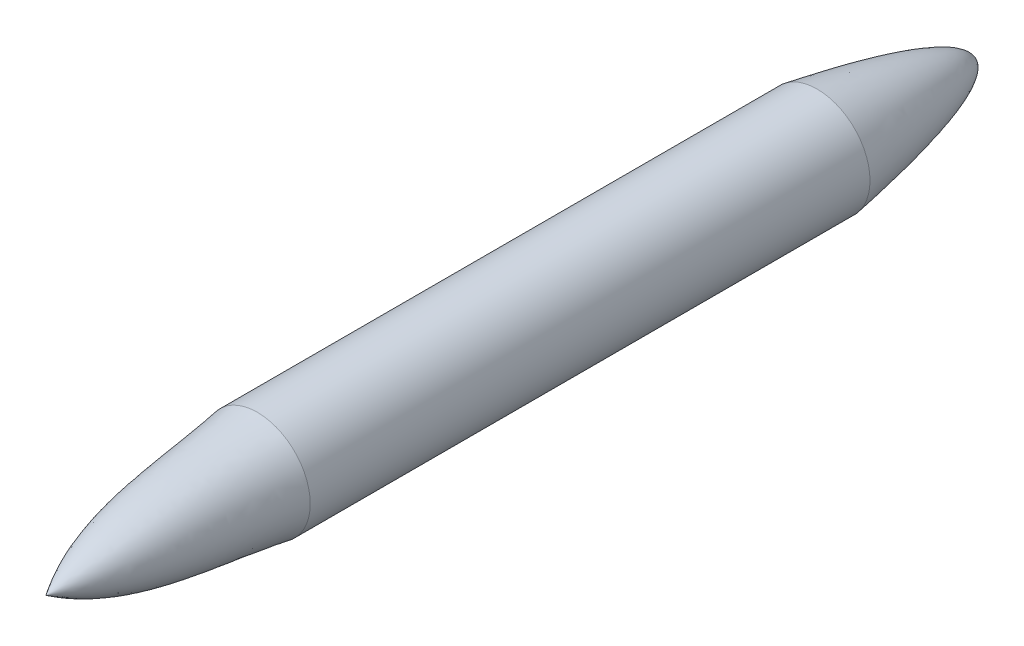
from build123d import *


with BuildPart() as part:
    # Base → Revolve3 (revolve)
    with BuildSketch(Plane(origin=(0, 0, 0), x_dir=(1, 0, 0), z_dir=(0, 1, 0)), mode=Mode.PRIVATE) as revolve3_sk:
        with BuildLine():
            Line((-1993.392, 11595.07968), (-1993.392, -9521.952))
            add(Edge.make_bspline(
                [(-1993.392, -9521.952), (-1540.989964071, -12218.281631648), (-1564.1113168, -15114.507066816), (0, -17495.52)],
                knots=[0, 0, 0, 0, 1, 1, 1, 1], degree=3))
            Line((0, -17495.52), (0, 17495.52))
            add(Edge.make_bspline(
                [(-1993.392, 11595.07968), (-996.695999987, 17495.519999923), (0, 17495.52)],
                knots=[0, 0, 0, 0.5, 0.5, 0.5], degree=2))
        make_face()
    revolve(revolve3_sk.sketch.rotate(Axis((0, 0, -17495.52), (0, 0, -1)), 180), axis=Axis((0, 0, -17495.52), (0, 0, -1)))


solid = part.part
